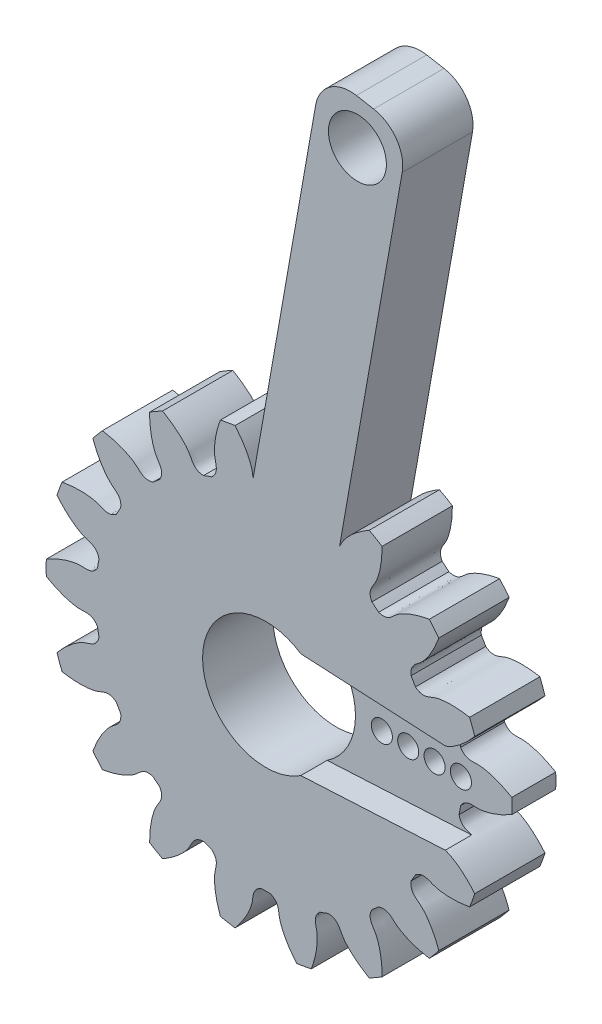
from build123d import *

# Parameters (mm, degrees)
SKETCH_1_R               = 12.5
EXTRUDE_1_DEPTH          = 4
CUT_EXTRUDE_1_DEPTH      = 19.12456896
PATTERN_CIRCULAR_1_COUNT = 18
SKETCH_4_R               = 1.65
CUT_EXTRUDE_2_DEPTH      = 10
SKETCH_5_R               = 1.65
EXTRUDE_2_DEPTH          = 4
FILLET_1_R               = 2
SKETCH_7_R               = 2.4
CUT_EXTRUDE_3_DEPTH      = 11
SKETCH_8_R               = 3.6
CUT_EXTRUDE_4_DEPTH      = 11
CUT_EXTRUDE_6_DEPTH      = 1.5
SKETCH_12_R              = 0.6
CUT_EXTRUDE_7_DEPTH      = 11.5


with BuildPart() as part:
    # 草图1 → 凸台-拉伸1 (new body)
    with BuildSketch(Plane.XY):
        Circle(SKETCH_1_R)
    extrude(amount=EXTRUDE_1_DEPTH)

    # 草图2 → 切除-拉伸1 (cut, through all)
    with BuildSketch(Plane.XY):
        with BuildLine():
            ThreePointArc((0.249254449, 9.684292874), (0, 9.6875), (-0.249254449, 9.684292874))
            add(Edge.make_bspline(
                [(-0.249254449, 9.684292874), (-0.76888005, 9.898350488), (-0.703486312, 10.298374378), (-0.789791143, 10.678244321), (-0.7984394, 10.713133251), (-0.808884492, 10.751925593), (-0.821280887, 10.794562728), (-0.835787538, 10.84098021), (-0.852559647, 10.891109165), (-0.871751067, 10.944875915), (-0.893513396, 11.002202161), (-0.917996094, 11.063004996), (-0.945346283, 11.127196973), (-0.975708651, 11.194686165), (-1.009225323, 11.265376225), (-1.046035746, 11.339166457), (-1.086276569, 11.41595188), (-1.130081531, 11.495623304), (-1.177581345, 11.578067405), (-1.228903588, 11.663166799), (-1.28417259, 11.750800128), (-1.343509328, 11.84084214), (-1.407031319, 11.933163775), (-1.474852518, 12.027632257), (-1.547083214, 12.124111182), (-1.623829934, 12.222460613), (-1.705195343, 12.32253718), (-1.791278154, 12.424194171), (-1.882173032, 12.527281643), (-1.977970504, 12.631646517), (-2.078756878, 12.737132691), (-2.184614151, 12.843581143), (-2.295619932, 12.950830044), (-2.411847363, 13.05871487), (-2.533365041, 13.167068516), (-2.660236943, 13.275721413), (-2.792522359, 13.384501647), (-2.930275825, 13.493235075), (-3.073547051, 13.601745454), (-3.222380872, 13.709854557), (-3.376817155, 13.817382307), (-3.592594191, 13.961299395), (-3.759444298, 14.065417224), (-3.873201114, 14.133347975)],
                knots=[0, 0, 0, 0, 0.187591972, 0.192996016, 0.1991206, 0.205965723, 0.213531386, 0.221817587, 0.230824328, 0.240551609, 0.250999428, 0.262167787, 0.274056685, 0.286666122, 0.299996099, 0.314046614, 0.32881767, 0.344309264, 0.360521397, 0.37745407, 0.395107283, 0.413481034, 0.432575325, 0.452390155, 0.472925524, 0.494181432, 0.51615788, 0.538854867, 0.562272393, 0.586410459, 0.611269064, 0.636848208, 0.663147891, 0.690168114, 0.717908876, 0.746370177, 0.775552017, 0.805454397, 0.836077316, 0.867420774, 0.899484772, 0.932269309, 1, 1, 1, 1], degree=3))
            ThreePointArc((-3.873201114, 14.133347975), (0, 14.654460476), (3.873201114, 14.133347975))
            add(Edge.make_bspline(
                [(0.249254449, 9.684292874), (0.76888005, 9.898350488), (0.703486312, 10.298374378), (0.789791143, 10.678244321), (0.7984394, 10.713133251), (0.808884492, 10.751925593), (0.821280887, 10.794562728), (0.835787538, 10.84098021), (0.852559647, 10.891109165), (0.871751067, 10.944875915), (0.893513396, 11.002202161), (0.917996094, 11.063004996), (0.945346283, 11.127196973), (0.975708651, 11.194686165), (1.009225323, 11.265376225), (1.046035746, 11.339166457), (1.086276569, 11.41595188), (1.130081531, 11.495623304), (1.177581345, 11.578067405), (1.228903588, 11.663166799), (1.28417259, 11.750800128), (1.343509328, 11.84084214), (1.407031319, 11.933163775), (1.474852518, 12.027632257), (1.547083214, 12.124111182), (1.623829934, 12.222460613), (1.705195343, 12.32253718), (1.791278154, 12.424194171), (1.882173032, 12.527281643), (1.977970504, 12.631646517), (2.078756878, 12.737132691), (2.184614151, 12.843581143), (2.295619932, 12.950830044), (2.411847363, 13.05871487), (2.533365041, 13.167068516), (2.660236943, 13.275721413), (2.792522359, 13.384501647), (2.930275825, 13.493235075), (3.073547051, 13.601745454), (3.222380872, 13.709854557), (3.376817155, 13.817382307), (3.592594191, 13.961299395), (3.759444298, 14.065417224), (3.873201114, 14.133347975)],
                knots=[0, 0, 0, 0, 0.187591972, 0.192996016, 0.1991206, 0.205965723, 0.213531386, 0.221817587, 0.230824328, 0.240551609, 0.250999428, 0.262167787, 0.274056685, 0.286666122, 0.299996099, 0.314046614, 0.32881767, 0.344309264, 0.360521397, 0.37745407, 0.395107283, 0.413481034, 0.432575325, 0.452390155, 0.472925524, 0.494181432, 0.51615788, 0.538854867, 0.562272393, 0.586410459, 0.611269064, 0.636848208, 0.663147891, 0.690168114, 0.717908876, 0.746370177, 0.775552017, 0.805454397, 0.836077316, 0.867420774, 0.899484772, 0.932269309, 1, 1, 1, 1], degree=3))
        make_face()
    cut_extrude_1 = extrude(amount=CUT_EXTRUDE_1_DEPTH, mode=Mode.SUBTRACT)

    # 阵列(圆周)1: 切除-拉伸1 ×18 about axis
    pattern_circular_1_axis = Axis((0, 0, -0.15), (0, 0, 1))
    for i in range(1, PATTERN_CIRCULAR_1_COUNT):
        add(cut_extrude_1.rotate(pattern_circular_1_axis, i * 360 / PATTERN_CIRCULAR_1_COUNT), mode=Mode.SUBTRACT)

    # 草图4 → 切除-拉伸2 (cut)
    with BuildSketch(Plane.XY.offset(4)):
        Circle(SKETCH_4_R)
    extrude(amount=-CUT_EXTRUDE_2_DEPTH, mode=Mode.SUBTRACT)

    # 草图5 → 凸台-拉伸2 (add)
    with BuildSketch(Plane.XY.offset(4)):
        Polygon((0, 14.396926208), (3.181546392, 32.440372417), (8.105585157, 31.572131529), (4.924038765, 13.52868532), (3.164643997, 3.550661756), (-1.759394768, 4.418902644), align=None)
        with Locations((5.20944533, 29.54423259)):
            Circle(SKETCH_5_R, mode=Mode.SUBTRACT)
    extrude(amount=-EXTRUDE_2_DEPTH)

    # 圆角1
    fillet_1_edges = [part.edges().sort_by_distance(p)[0] for p in [
        (8.105585157, 31.572131529, 2),
        (3.181546392, 32.440372417, 2),
    ]]
    fillet(fillet_1_edges, radius=FILLET_1_R)

    # 草图7 → 切除-拉伸3 (cut)
    with BuildSketch(Plane(origin=(0, 0, 0), x_dir=(-1, 0, 0), z_dir=(0, 0, -1))):
        Circle(SKETCH_7_R)
    extrude(amount=-CUT_EXTRUDE_3_DEPTH, mode=Mode.SUBTRACT)

    # 草图8 → 切除-拉伸4 (cut)
    with BuildSketch(Plane(origin=(0, 0, 0), x_dir=(-1, 0, 0), z_dir=(0, 0, -1))):
        Circle(SKETCH_8_R)
    extrude(amount=-CUT_EXTRUDE_4_DEPTH, mode=Mode.SUBTRACT)

    # 草图11 → 切除-拉伸6 (cut)
    with BuildSketch(Plane.XY.offset(4)):
        with BuildLine():
            Line((1.989974874, -3), (10.209466263, -2.569234709))
            add(Edge.make_bspline(
                [(10.209466263, -2.569234709), (10.256186465, -2.584620751), (10.312723647, -2.604243803), (10.39121712, -2.637239536), (10.452111647, -2.665101401), (10.535119971, -2.707143922), (10.63117082, -2.760685606), (10.739452731, -2.826825718), (10.859758696, -2.907060076), (10.942527996, -2.967203357), (10.985889138, -3)],
                knots=[0.162442646, 0.162442646, 0.162442646, 0.162442646, 0.187591972, 0.192996016, 0.205965723, 0.221817587, 0.240551609, 0.262167787, 0.286666122, 0.314458056, 0.314458056, 0.314458056, 0.314458056], degree=3))
            Line((10.985889138, -3), (16.296887652, -3))
            Line((16.296887652, -3), (16.296887652, 3))
            Line((16.296887652, 3), (10.985889406, 3))
            add(Edge.make_bspline(
                [(10.985889406, 3), (10.942528111, 2.967203441), (10.859758901, 2.907059537), (10.739452787, 2.826825504), (10.631170878, 2.76068534), (10.53512018, 2.707143224), (10.452111647, 2.665101401), (10.39121712, 2.637239536), (10.312723647, 2.604243803), (10.256186465, 2.584620751), (10.209466263, 2.569234709)],
                knots=[0.685541908, 0.685541908, 0.685541908, 0.685541908, 0.713333878, 0.737832213, 0.759448391, 0.778182413, 0.794034277, 0.807003984, 0.812408028, 0.837557354, 0.837557354, 0.837557354, 0.837557354], degree=3))
            Line((10.209466263, 2.569234709), (1.989974874, 3))
            Line((1.989974874, 3), (-0.776042269, 3))
            Line((-0.776042269, 3), (-0.776042269, -3))
            Line((-0.776042269, -3), (1.989974874, -3))
        make_face()
    extrude(amount=-CUT_EXTRUDE_6_DEPTH, mode=Mode.SUBTRACT)

    # 草图12 → 切除-拉伸7 (cut)
    with BuildSketch(Plane.XY.offset(2.5)):
        with Locations((6.6, 0)):
            Circle(SKETCH_12_R)
        with Locations((8.1, 0)):
            Circle(SKETCH_12_R)
        with Locations((9.6, 0)):
            Circle(SKETCH_12_R)
        with Locations((5.1, 0)):
            Circle(SKETCH_12_R)
    extrude(amount=-CUT_EXTRUDE_7_DEPTH, mode=Mode.SUBTRACT)


solid = part.part
